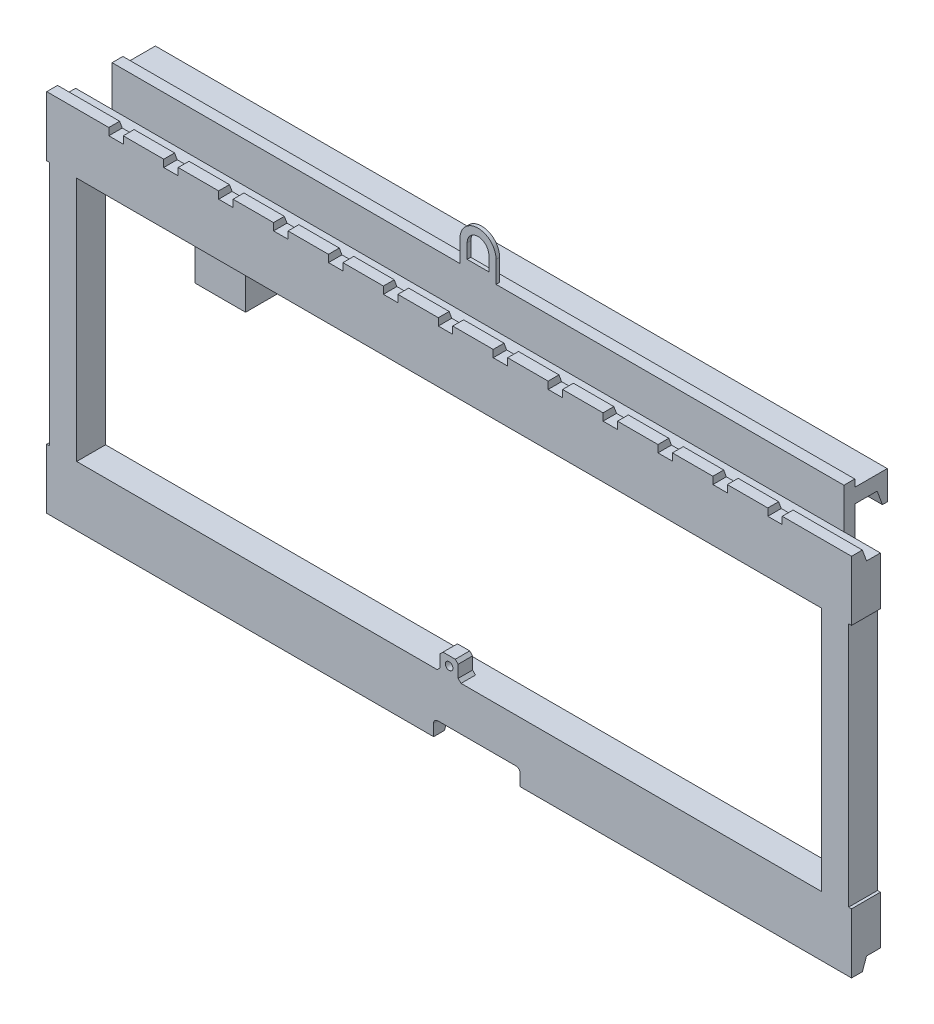
from build123d import *

# Parameters (mm, degrees)
BOSS_EXTRUDE1_DEPTH  = 557.5
SKETCH2_W            = 37.5
SKETCH2_H            = 40
BOSS_EXTRUDE2_DEPTH  = 340
BOSS_EXTRUDE3_DEPTH  = 1115
SKETCH4_W            = 120
SKETCH4_H            = 22
CUT_EXTRUDE1_DEPTH   = 754.951092578
FILLET1_R            = 6
SKETCH8_W            = 20
SKETCH8_H            = 10
CUT_EXTRUDE3_DEPTH   = 754.951092578
SKETCH9_W            = 25
SKETCH9_H            = 25
SKETCH9_R            = 5.25
BOSS_EXTRUDE6_DEPTH  = 20
CHAMFER1_SIZE        = 4
SKETCH10_W           = 1014
SKETCH10_H           = 110
BOSS_EXTRUDE7_DEPTH  = 15
BOSS_EXTRUDE8_DEPTH  = 507
BOSS_EXTRUDE9_DEPTH  = 5
BOSS_EXTRUDE10_START = -14
SKETCH13_W           = 70
SKETCH13_H           = 58
BOSS_EXTRUDE10_DEPTH = 45


with BuildPart() as part:
    # Sketch1 → Boss-Extrude1 (new, symmetric)
    with BuildSketch(Plane(origin=(0, 0, 0), x_dir=(0, 0, -1), z_dir=(1, 0, 0))):
        Polygon((0, 0), (0, 83), (40, 83), (40, 16), (20.823523748, 16), (15, 0), align=None)
    extrude(amount=BOSS_EXTRUDE1_DEPTH, both=True)

    # Sketch2 → Boss-Extrude2 (add)
    with BuildSketch(Plane(origin=(0, 83, 0), x_dir=(1, 0, 0), z_dir=(0, 1, 0))):
        with Locations((-534.75, 20)):
            Rectangle(SKETCH2_W, SKETCH2_H)
        with Locations((534.75, 20)):
            Rectangle(SKETCH2_W, SKETCH2_H)
    extrude(amount=BOSS_EXTRUDE2_DEPTH)

    # Sketch3 → Boss-Extrude3 (add)
    with BuildSketch(Plane(origin=(557.5, 0, 0), x_dir=(0, 0, -1), z_dir=(1, 0, 0))):
        Polygon((0, 423), (0, 506), (15, 506), (20.823523748, 490), (40, 490), (40, 423), align=None)
    extrude(amount=-BOSS_EXTRUDE3_DEPTH)

    # Sketch4 → Cut-Extrude1 (cut, through all)
    with BuildSketch(Plane.XY):
        with Locations((38.5, 11)):
            Rectangle(SKETCH4_W, SKETCH4_H)
    extrude(amount=-CUT_EXTRUDE1_DEPTH, mode=Mode.SUBTRACT)

    # Fillet1
    fillet1_edges = [part.edges().sort_by_distance(p)[0] for p in [
        (98.5, 22, -20),
        (-21.5, 22, -20),
    ]]
    fillet(fillet1_edges, radius=FILLET1_R)

    # Sketch8 → Cut-Extrude3 (cut, through all)
    with BuildSketch(Plane.XY):
        with Locations((-461.5, 501)):
            Rectangle(SKETCH8_W, SKETCH8_H)
        with Locations((-385.416666667, 501)):
            Rectangle(SKETCH8_W, SKETCH8_H)
        with Locations((-309.333333333, 501)):
            Rectangle(SKETCH8_W, SKETCH8_H)
        with Locations((-233.25, 501)):
            Rectangle(SKETCH8_W, SKETCH8_H)
        with Locations((-157.166666667, 501)):
            Rectangle(SKETCH8_W, SKETCH8_H)
        with Locations((-81.083333333, 501)):
            Rectangle(SKETCH8_W, SKETCH8_H)
        with Locations((-5, 501)):
            Rectangle(SKETCH8_W, SKETCH8_H)
        with Locations((71.083333333, 501)):
            Rectangle(SKETCH8_W, SKETCH8_H)
        with Locations((147.166666667, 501)):
            Rectangle(SKETCH8_W, SKETCH8_H)
        with Locations((223.25, 501)):
            Rectangle(SKETCH8_W, SKETCH8_H)
        with Locations((299.333333333, 501)):
            Rectangle(SKETCH8_W, SKETCH8_H)
        with Locations((375.416666667, 501)):
            Rectangle(SKETCH8_W, SKETCH8_H)
        with Locations((451.5, 501)):
            Rectangle(SKETCH8_W, SKETCH8_H)
    extrude(amount=-CUT_EXTRUDE3_DEPTH, mode=Mode.SUBTRACT)

    # Sketch9 → Boss-Extrude6 (add)
    with BuildSketch(Plane.XY):
        with Locations((0, 95.5)):
            Rectangle(SKETCH9_W, SKETCH9_H)
        with Locations((0, 95.5)):
            Circle(SKETCH9_R, mode=Mode.SUBTRACT)
    extrude(amount=-BOSS_EXTRUDE6_DEPTH)

    # Chamfer1
    chamfer1_edges = [part.edges().sort_by_distance(p)[0] for p in [
        (-12.5, 83, -10),
        (-12.5, 108, -10),
        (12.5, 108, -10),
        (12.5, 83, -10),
    ]]
    chamfer(chamfer1_edges, length=CHAMFER1_SIZE)

    # Sketch10 → Boss-Extrude7 (add)
    with BuildSketch(Plane(origin=(0, 0, -40), x_dir=(-1, 0, 0), z_dir=(0, 0, -1))):
        with Locations((0, 491)):
            Rectangle(SKETCH10_W, SKETCH10_H)
    extrude(amount=BOSS_EXTRUDE7_DEPTH)

    # Sketch11 → Boss-Extrude8 (add, symmetric)
    with BuildSketch(Plane(origin=(0, 0, 0), x_dir=(0, 0, -1), z_dir=(1, 0, 0))):
        Polygon((55, 536), (100, 536), (100, 496), (93.279404685, 496), (86, 516), (55, 516), align=None)
    extrude(amount=BOSS_EXTRUDE8_DEPTH, both=True)

    # Sketch12 → Boss-Extrude9 (add)
    with BuildSketch(Plane.XY.offset(-40)):
        with BuildLine():
            Line((-25, 546), (-25, 576))
            ThreePointArc((-25, 576), (0, 601), (25, 576))
            Line((25, 576), (25, 546))
            Line((25, 546), (-25, 546))
        make_face()
        with BuildLine():
            Line((-15, 556), (-15, 576))
            ThreePointArc((-15, 576), (0, 591), (15, 576))
            Line((15, 576), (15, 556))
            Line((15, 556), (-15, 556))
        make_face(mode=Mode.SUBTRACT)
    extrude(amount=-BOSS_EXTRUDE9_DEPTH)

    # Sketch13 → Boss-Extrude10 (add)
    with BuildSketch(Plane.XY.offset(BOSS_EXTRUDE10_START)):
        with Locations((-331, 394)):
            Rectangle(SKETCH13_W, SKETCH13_H)
    extrude(amount=-BOSS_EXTRUDE10_DEPTH)


solid = part.part
